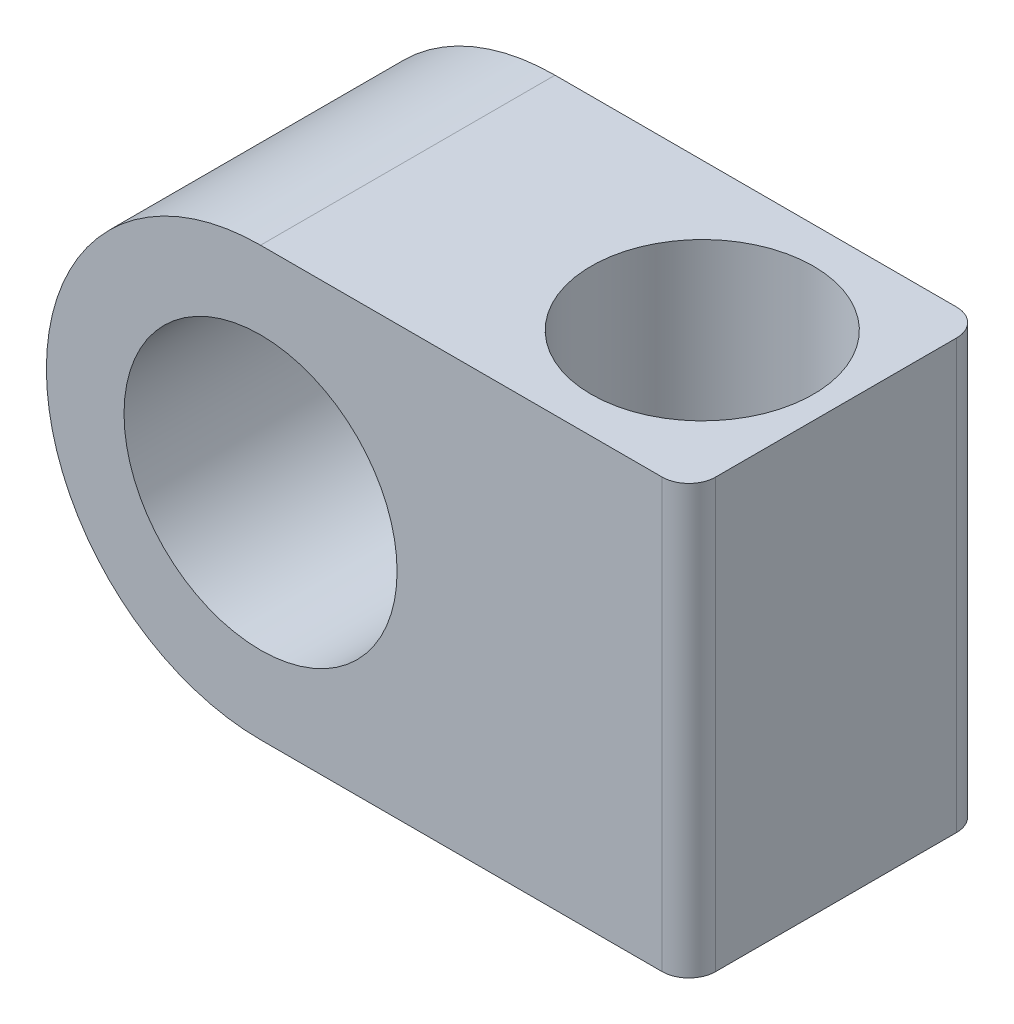
from build123d import *

# Parameters (mm, degrees)
CROQUIS1_R                 = 8
SALIENTE_EXTRUIR1_DEPTH    = 11
CROQUIS2_W                 = 11
CROQUIS2_H                 = 16
SALIENTE_EXTRUIR2_DEPTH    = 16
CROQUIS3_R                 = 5.1
CORTAR_EXTRUIR1_DEPTH      = 20
CORTAR_EXTRUIR2_DEPTH      = 22
CORTAR_EXTRUIR2_DEPTH_BACK = 22
CROQUIS4_R                 = 4.15
REDONDEO2_R                = 1
REDONDEO3_R                = 1


with BuildPart() as part:
    # Croquis1 → Saliente-Extruir1 (new body)
    with BuildSketch(Plane.XY):
        Circle(CROQUIS1_R)
    extrude(amount=SALIENTE_EXTRUIR1_DEPTH)

    # Croquis2 → Saliente-Extruir2 (add)
    with BuildSketch(Plane(origin=(0, 0, 0), x_dir=(0, 0, -1), z_dir=(1, 0, 0))):
        with Locations((-5.5, 0)):
            Rectangle(CROQUIS2_W, CROQUIS2_H)
    extrude(amount=SALIENTE_EXTRUIR2_DEPTH)

    # Croquis3 → Cortar-Extruir1 (cut)
    with BuildSketch(Plane.XY.offset(11)):
        Circle(CROQUIS3_R)
    extrude(amount=-CORTAR_EXTRUIR1_DEPTH, mode=Mode.SUBTRACT)

    # Croquis4 → Cortar-Extruir2 (cut, two sides: drawn at the far end of the back side and taken through both)
    with BuildSketch(Plane(origin=(0, 0, 0), x_dir=(1, 0, 0), z_dir=(0, 1, 0)).offset(-CORTAR_EXTRUIR2_DEPTH_BACK)):
        with Locations(Location((11, -5.5, 0), (0, 0, 270))):
            Circle(CROQUIS4_R)
    extrude(amount=CORTAR_EXTRUIR2_DEPTH + CORTAR_EXTRUIR2_DEPTH_BACK, mode=Mode.SUBTRACT)

    # Redondeo2
    redondeo2_edges = [part.edges().sort_by_distance(p)[0] for p in [
        (16, 0, 0),
    ]]
    fillet(redondeo2_edges, radius=REDONDEO2_R)

    # Redondeo3
    redondeo3_edges = [part.edges().sort_by_distance(p)[0] for p in [
        (16, 0, 11),
    ]]
    fillet(redondeo3_edges, radius=REDONDEO3_R)


solid = part.part
